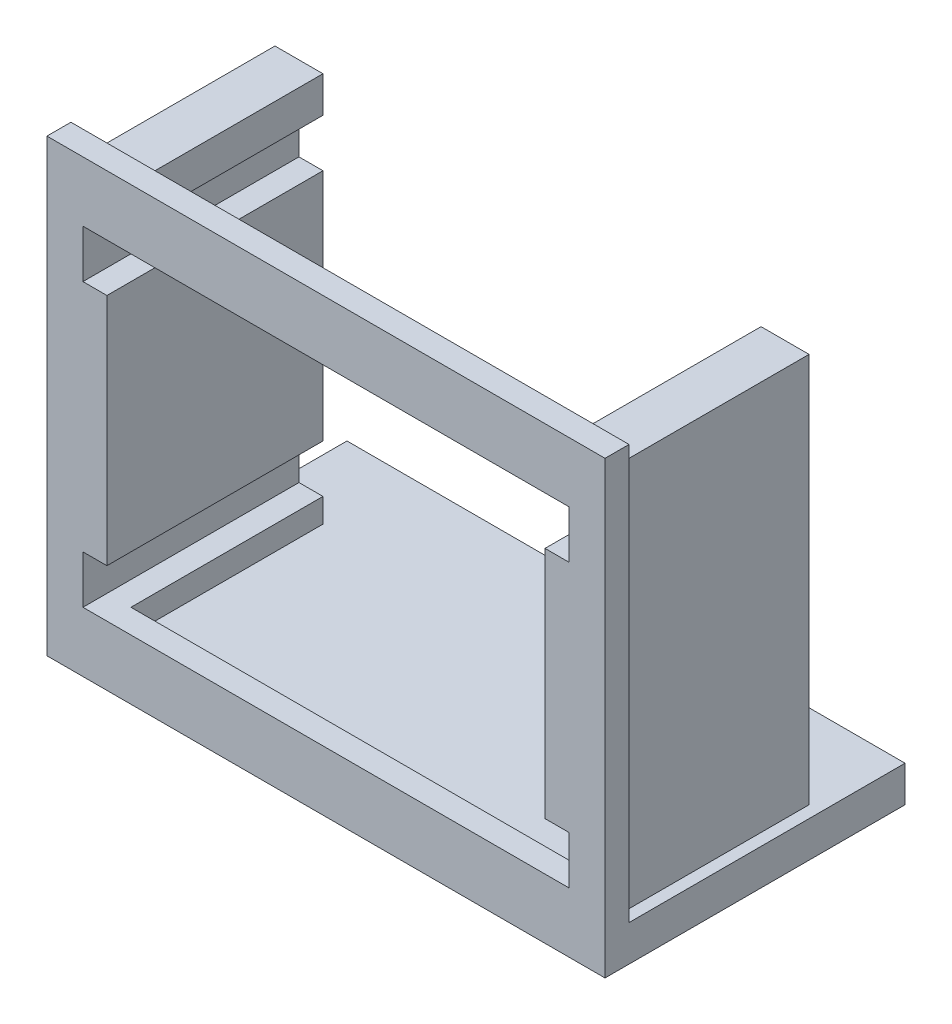
from build123d import *

# Parameters (mm, degrees)
SKETCH2_W                = 200
SKETCH2_H                = 150
BOSS_EXTRUDE1_DEPTH      = 80
FILLET1_R                = 10
SHELL1_T                 = -2
SHELL1_THICKNESS_2_DEPTH = 13
SKETCH5_W                = 2
SKETCH5_H                = 4
CUT_EXTRUDE1_DEPTH       = 2
BOSS_EXTRUDE2_DEPTH      = 16
SKETCH7_W                = 36.5
SKETCH7_H                = 27.5
CUT_EXTRUDE2_DEPTH       = 2
BOSS_EXTRUDE3_DEPTH      = 16
SKETCH10_W               = 36.5
SKETCH10_H               = 27.5
CUT_EXTRUDE4_DEPTH       = 2
BOSS_EXTRUDE4_DEPTH      = 16
SKETCH13_W               = 38
SKETCH13_H               = 19.1
CUT_EXTRUDE5_DEPTH       = 2
BOSS_EXTRUDE5_DEPTH      = 13.5
SKETCH15_W               = 10.5
SKETCH15_H               = 9.367949192
CUT_EXTRUDE6_DEPTH       = 3
CUT_EXTRUDE8_REACH       = 150.408
SKETCH20_R               = 8
SPLIT1_SURFACE_1_BACK    = 263.488
SPLIT1_SURFACE_1_DEPTH   = 526.976
SPLIT1_SURFACE_2_BACK    = 263.488
SPLIT1_SURFACE_2_DEPTH   = 526.976
SPLIT2_SURFACE_3_BACK    = 263.488
SPLIT2_SURFACE_3_DEPTH   = 526.976
SPLIT2_SURFACE_4_BACK    = 263.488
SPLIT2_SURFACE_4_DEPTH   = 526.976


with BuildPart() as part:
    # Sketch2 → Boss-Extrude1 (new body)
    with BuildSketch(Plane(origin=(0, 0, 0), x_dir=(1, 0, 0), z_dir=(0, 1, 0))):
        Rectangle(SKETCH2_W, SKETCH2_H)
    extrude(amount=BOSS_EXTRUDE1_DEPTH)

    # Fillet1
    fillet1_edges = [part.edges().sort_by_distance(p)[0] for p in [
        (100, 40, 75),
        (-100, 40, 75),
        (-100, 40, -75),
        (100, 40, -75),
    ]]
    fillet(fillet1_edges, radius=FILLET1_R)

    # Shell1
    shell1_openings = [part.faces().sort_by_distance(p)[0] for p in [
        (0, 80, 0),
    ]]
    offset(amount=SHELL1_T, openings=shell1_openings, kind=Kind.INTERSECTION)

    # Shell1 thickness 2 face (on inner face of the shell) → Shell1 thickness 2 (add)
    with BuildSketch(Plane(origin=(0, 2, 0), x_dir=(0, 0, -1), z_dir=(0, -1, 0))):
        with BuildLine():
            ThreePointArc((73, -90), (70.656854249, -95.656854249), (65, -98))
            Line((65, -98), (-65, -98))
            ThreePointArc((-65, -98), (-70.656854249, -95.656854249), (-73, -90))
            Line((-73, -90), (-73, 90))
            ThreePointArc((-73, 90), (-70.656854249, 95.656854249), (-65, 98))
            Line((-65, 98), (65, 98))
            ThreePointArc((65, 98), (70.656854249, 95.656854249), (73, 90))
            Line((73, 90), (73, -90))
        make_face()
    extrude(amount=-SHELL1_THICKNESS_2_DEPTH)

    # Sketch5 → Cut-Extrude1 (cut)
    with BuildSketch(Plane.XY.offset(75)):
        Polygon((18.25, 44.5), (-18.25, 44.5), (-18.25, 40.5), (-18.25, 21), (-18.25, 17), (18.25, 17), (18.25, 21), (18.25, 40.5), align=None)
        with Locations((-19.25, 42.5)):
            Rectangle(SKETCH5_W, SKETCH5_H)
        with Locations((19.25, 42.5)):
            Rectangle(SKETCH5_W, SKETCH5_H)
        with Locations((-19.25, 19)):
            Rectangle(SKETCH5_W, SKETCH5_H)
        with Locations((19.25, 19)):
            Rectangle(SKETCH5_W, SKETCH5_H)
    extrude(amount=-CUT_EXTRUDE1_DEPTH, mode=Mode.SUBTRACT)

    # Sketch6 → Boss-Extrude2 (add)
    with BuildSketch(Plane(origin=(0, 0, 73), x_dir=(-1, 0, 0), z_dir=(0, 0, -1))):
        Polygon((18.25, 15), (22.25, 15), (22.25, 47.5), (18.25, 47.5), (18.25, 44.5), (20.25, 44.5), (20.25, 40.5), (18.25, 40.5), (18.25, 21), (20.25, 21), (20.25, 17), (18.25, 17), align=None)
        Polygon((-22.25, 47.5), (-22.25, 15), (-18.25, 15), (-18.25, 17), (-20.25, 17), (-20.25, 21), (-18.25, 21), (-18.25, 40.5), (-20.25, 40.5), (-20.25, 44.5), (-18.25, 44.5), (-18.25, 47.5), align=None)
    extrude(amount=BOSS_EXTRUDE2_DEPTH)

    # Sketch7 → Cut-Extrude2 (cut)
    with BuildSketch(Plane(origin=(100, 0, 0), x_dir=(0, 0, -1), z_dir=(1, 0, 0))):
        with Locations((0, 30.75)):
            Rectangle(SKETCH7_W, SKETCH7_H)
        Polygon((-18.25, 43.5), (-19.75, 44.366025404), (-19.75, 41.633974596), (-18.25, 42.5), align=None)
        Polygon((-19.75, 19.866025404), (-18.25, 19), (-18.25, 18), (-19.75, 17.133974596), align=None)
        Polygon((19.75, 17.133974596), (19.75, 19.866025404), (18.25, 19), (18.25, 18), align=None)
        Polygon((19.75, 41.633974596), (18.25, 42.5), (18.25, 43.5), (19.75, 44.366025404), align=None)
    extrude(amount=-CUT_EXTRUDE2_DEPTH, mode=Mode.SUBTRACT)

    # Sketch8 → Boss-Extrude3 (add)
    with BuildSketch(Plane.ZY.offset(-98)):
        Polygon((-21.25, 47.5), (-18.25, 47.5), (-18.25, 43.5), (-19.75, 44.366025404), (-19.75, 41.633974596), (-18.25, 42.5), (-18.25, 19), (-19.75, 19.866025404), (-19.75, 17.133974596), (-18.25, 18), (-18.25, 15), (-21.25, 15), align=None)
        Polygon((19.75, 44.366025404), (18.25, 43.5), (18.25, 47.5), (21.25, 47.5), (21.25, 15), (18.25, 15), (18.25, 18), (19.75, 17.133974596), (19.75, 19.866025404), (18.25, 19), (18.25, 42.5), (19.75, 41.633974596), align=None)
    extrude(amount=BOSS_EXTRUDE3_DEPTH)

    # Sketch10 → Cut-Extrude4 (cut)
    with BuildSketch(Plane.ZY.offset(100)):
        with Locations((0, 30.75)):
            Rectangle(SKETCH10_W, SKETCH10_H)
        Polygon((-18.25, 43.5), (-19.75, 44.366025404), (-19.75, 41.633974596), (-18.25, 42.5), align=None)
        Polygon((-19.75, 19.866025404), (-18.25, 19), (-18.25, 18), (-19.75, 17.133974596), align=None)
        Polygon((19.75, 17.133974596), (19.75, 19.866025404), (18.25, 19), (18.25, 18), align=None)
        Polygon((19.75, 41.633974596), (18.25, 42.5), (18.25, 43.5), (19.75, 44.366025404), align=None)
    extrude(amount=-CUT_EXTRUDE4_DEPTH, mode=Mode.SUBTRACT)

    # Sketch11 → Boss-Extrude4 (add)
    with BuildSketch(Plane(origin=(-98, 0, 0), x_dir=(0, 0, -1), z_dir=(1, 0, 0))):
        Polygon((-18.25, 47.5), (-21.25, 47.5), (-21.25, 15), (-18.25, 15), (-18.25, 18), (-19.75, 17.133974596), (-19.75, 19.866025404), (-18.25, 19), (-18.25, 42.5), (-19.75, 41.633974596), (-19.75, 44.366025404), (-18.25, 43.5), align=None)
        Polygon((19.75, 44.366025404), (18.25, 43.5), (18.25, 47.5), (21.25, 47.5), (21.25, 15), (18.25, 15), (18.25, 18), (19.75, 17.133974596), (19.75, 19.866025404), (18.25, 19), (18.25, 42.5), (19.75, 41.633974596), align=None)
    extrude(amount=BOSS_EXTRUDE4_DEPTH)

    # Sketch13 → Cut-Extrude5 (cut)
    with BuildSketch(Plane.XY.offset(75)):
        Polygon((41, 39.3), (39.5, 40.166025404), (39.5, 37.433974596), (41, 38.3), align=None)
        with Locations((60, 30.75)):
            Rectangle(SKETCH13_W, SKETCH13_H)
        Polygon((41, 22.2), (39.5, 21.333974596), (39.5, 24.066025404), (41, 23.2), align=None)
        Polygon((79, 22.2), (79, 23.2), (80.5, 24.066025404), (80.5, 21.333974596), align=None)
        Polygon((79, 39.3), (80.5, 40.166025404), (80.5, 37.433974596), (79, 38.3), align=None)
    extrude(amount=-CUT_EXTRUDE5_DEPTH, mode=Mode.SUBTRACT)

    # Sketch14 → Boss-Extrude5 (add)
    with BuildSketch(Plane(origin=(0, 0, 73), x_dir=(-1, 0, 0), z_dir=(0, 0, -1))):
        Polygon((-79, 43.3), (-82, 43.3), (-82, 15), (-79, 15), (-79, 22.2), (-80.5, 21.333974596), (-80.5, 24.066025404), (-79, 23.2), (-79, 38.3), (-80.5, 37.433974596), (-80.5, 40.166025404), (-79, 39.3), align=None)
        Polygon((-39.5, 40.166025404), (-41, 39.3), (-41, 43.3), (-38, 43.3), (-38, 15), (-41, 15), (-41, 22.2), (-39.5, 21.333974596), (-39.5, 24.066025404), (-41, 23.2), (-41, 38.3), (-39.5, 37.433974596), align=None)
    extrude(amount=BOSS_EXTRUDE5_DEPTH)

    # Sketch15 → Cut-Extrude6 (cut)
    with BuildSketch(Plane.ZY.offset(-38)):
        with Locations((66.75, 30.75)):
            Rectangle(SKETCH15_W, SKETCH15_H)
    extrude(amount=-CUT_EXTRUDE6_DEPTH, mode=Mode.SUBTRACT)

    # Sketch18 → Cut-Revolve1 (revolve, cut)
    with BuildSketch(Plane(origin=(0, 0, 0), x_dir=(0, 0, -1), z_dir=(1, 0, 0)), mode=Mode.PRIVATE) as cut_revolve1_sk:
        Polygon((-42.5, 0), (-70, 0), (-47.5, 10), (-42.5, 10), align=None)
    revolve(cut_revolve1_sk.sketch.rotate(Axis((0, 0, 0), (0, 1, 0)), 180), axis=Axis((0, 0, 0), (0, 1, 0)), mode=Mode.SUBTRACT)

    # Cut-Extrude8: up to this face of the body (flat: up to its plane)
    cut_extrude8_end = Plane(part.part.faces().sort_by_distance((-0.172584848, 15, -0.486016332))[0])
    # Sketch20 → Cut-Extrude8 (cut, up to the picked face)
    with BuildSketch(Plane.XZ, mode=Mode.PRIVATE) as cut_extrude8_sk1:
        with Locations(Location((0, -42.5, 0), (0, 0, 270))):
            Circle(SKETCH20_R)
    cut_extrude8_tool1 = split(extrude(cut_extrude8_sk1.sketch, amount=-CUT_EXTRUDE8_REACH, mode=Mode.PRIVATE), bisect_by=cut_extrude8_end, keep=Keep.BOTH, mode=Mode.PRIVATE)
    add(cut_extrude8_tool1.solids().sort_by(Axis((0, 0, -42.5), (0, 1, 0)))[0], mode=Mode.SUBTRACT)


with BuildPart() as body_2:
    # Split1: the piece behind the surface
    add(part.part)
    # Split1 surface: a surface, the sketch's curves swept straight by 526.976 mm
    with BuildLine(Plane.XY.offset(75).offset(-SPLIT1_SURFACE_1_BACK), mode=Mode.PRIVATE) as split1_surface_1_path:
        Line((-23.25, 49.5), (23.25, 49.5))
        Line((23.25, 49.5), (23.25, 12))
        Line((23.25, 12), (-23.25, 12))
        Line((-23.25, 12), (-23.25, 49.5))
    split1_surface_1 = Shell.extrude(split1_surface_1_path.wire(), (0 * SPLIT1_SURFACE_1_DEPTH, 0 * SPLIT1_SURFACE_1_DEPTH, 1 * SPLIT1_SURFACE_1_DEPTH))
    split(bisect_by=split1_surface_1, keep=Keep.BOTTOM)


with BuildPart() as part_1:
    add(part.part)

    # Split1: split by a surface, the side it looks to stays
    # Split1 surface: a surface, the sketch's curves swept straight by 526.976 mm
    with BuildLine(Plane.XY.offset(75).offset(-SPLIT1_SURFACE_2_BACK), mode=Mode.PRIVATE) as split1_surface_2_path:
        Line((-23.25, 49.5), (23.25, 49.5))
        Line((23.25, 49.5), (23.25, 12))
        Line((23.25, 12), (-23.25, 12))
        Line((-23.25, 12), (-23.25, 49.5))
    split1_surface_2 = Shell.extrude(split1_surface_2_path.wire(), (0 * SPLIT1_SURFACE_2_DEPTH, 0 * SPLIT1_SURFACE_2_DEPTH, 1 * SPLIT1_SURFACE_2_DEPTH))
    split(bisect_by=split1_surface_2, keep=Keep.TOP)


with BuildPart() as body_3:
    # Split2: the piece behind the surface
    add(body_2.part)
    # Split2 surface: a surface, the sketch's curves swept straight by 526.976 mm
    with BuildLine(Plane(origin=(0, 15, 0), x_dir=(1, 0, 0), z_dir=(0, 1, 0)).offset(-SPLIT2_SURFACE_3_BACK), mode=Mode.PRIVATE) as split2_surface_3_path:
        Line((-23.25, -75), (23.25, -75))
        Line((23.25, -75), (23.25, -50))
        Line((23.25, -50), (-23.25, -50))
        Line((-23.25, -50), (-23.25, -75))
    split2_surface_3 = Shell.extrude(split2_surface_3_path.wire(), (0 * SPLIT2_SURFACE_3_DEPTH, 1 * SPLIT2_SURFACE_3_DEPTH, 0 * SPLIT2_SURFACE_3_DEPTH))
    split(bisect_by=split2_surface_3, keep=Keep.BOTTOM)


with BuildPart() as body_2_1:
    add(body_2.part)

    # Split2: split by a surface, the side it looks to stays
    # Split2 surface: a surface, the sketch's curves swept straight by 526.976 mm
    with BuildLine(Plane(origin=(0, 15, 0), x_dir=(1, 0, 0), z_dir=(0, 1, 0)).offset(-SPLIT2_SURFACE_4_BACK), mode=Mode.PRIVATE) as split2_surface_4_path:
        Line((-23.25, -75), (23.25, -75))
        Line((23.25, -75), (23.25, -50))
        Line((23.25, -50), (-23.25, -50))
        Line((-23.25, -50), (-23.25, -75))
    split2_surface_4 = Shell.extrude(split2_surface_4_path.wire(), (0 * SPLIT2_SURFACE_4_DEPTH, 1 * SPLIT2_SURFACE_4_DEPTH, 0 * SPLIT2_SURFACE_4_DEPTH))
    split(bisect_by=split2_surface_4, keep=Keep.TOP)


solid = body_2_1.part
